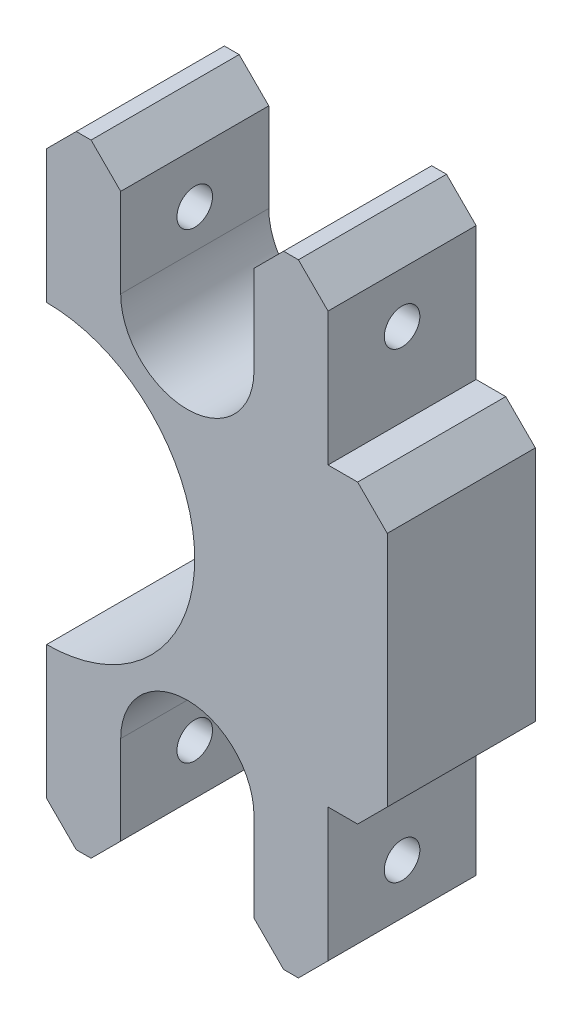
from build123d import *

# Parameters (mm, degrees)
BOSS_EXTRUDE1_DEPTH = 25
CUT_EXTRUDE1_DEPTH  = 50
SKETCH4_R           = 6
CUT_EXTRUDE2_DEPTH  = 200
CHAMFER1_SIZE       = 10
CHAMFER2_SIZE       = 10


with BuildPart() as part:
    # Sketch1 → Boss-Extrude1 (new, symmetric)
    with BuildSketch(Plane.XY):
        with BuildLine():
            Line((0, 50), (0, 105))
            Line((0, 105), (25, 105))
            Line((25, 105), (25, 65))
            Line((25, 65), (70, 65))
            Line((70, 65), (70, 105))
            Line((70, 105), (95, 105))
            Line((95, 105), (95, 50))
            Line((95, 50), (115, 50))
            Line((115, 50), (115, -50))
            Line((115, -50), (95, -50))
            Line((95, -50), (95, -105))
            Line((95, -105), (70, -105))
            Line((70, -105), (70, -65))
            Line((70, -65), (25, -65))
            Line((25, -65), (25, -105))
            Line((25, -105), (0, -105))
            Line((0, -105), (0, -50))
            ThreePointArc((0, -50), (50, 0), (0, 50))
        make_face()
    extrude(amount=BOSS_EXTRUDE1_DEPTH, both=True)

    # Sketch3 → Cut-Extrude1 (cut)
    with BuildSketch(Plane.XY.offset(25)):
        with BuildLine():
            Line((25, 65), (70, 65))
            ThreePointArc((70, 65), (47.5, 42.5), (25, 65))
        make_face()
        with BuildLine():
            Line((25, -65), (70, -65))
            ThreePointArc((70, -65), (47.5, -42.5), (25, -65))
        make_face()
    extrude(amount=-CUT_EXTRUDE1_DEPTH, mode=Mode.SUBTRACT)

    # Sketch4 → Cut-Extrude2 (cut)
    with BuildSketch(Plane.ZY):
        with Locations((0, 78)):
            Circle(SKETCH4_R)
        with Locations(Location((0, -78, 0), (0, 0, 270))):
            Circle(SKETCH4_R)
    extrude(amount=-CUT_EXTRUDE2_DEPTH, mode=Mode.SUBTRACT)

    # Chamfer1
    chamfer1_edges = [part.edges().sort_by_distance(p)[0] for p in [
        (115, 50, 0),
        (115, -50, 0),
    ]]
    chamfer(chamfer1_edges, length=CHAMFER1_SIZE)

    # Chamfer2
    chamfer2_edges = [part.edges().sort_by_distance(p)[0] for p in [
        (0, 105, 0),
        (25, 105, 0),
        (70, 105, 0),
        (95, 105, 0),
        (95, -105, 0),
        (70, -105, 0),
        (25, -105, 0),
        (0, -105, 0),
    ]]
    chamfer(chamfer2_edges, length=CHAMFER2_SIZE)


solid = part.part
